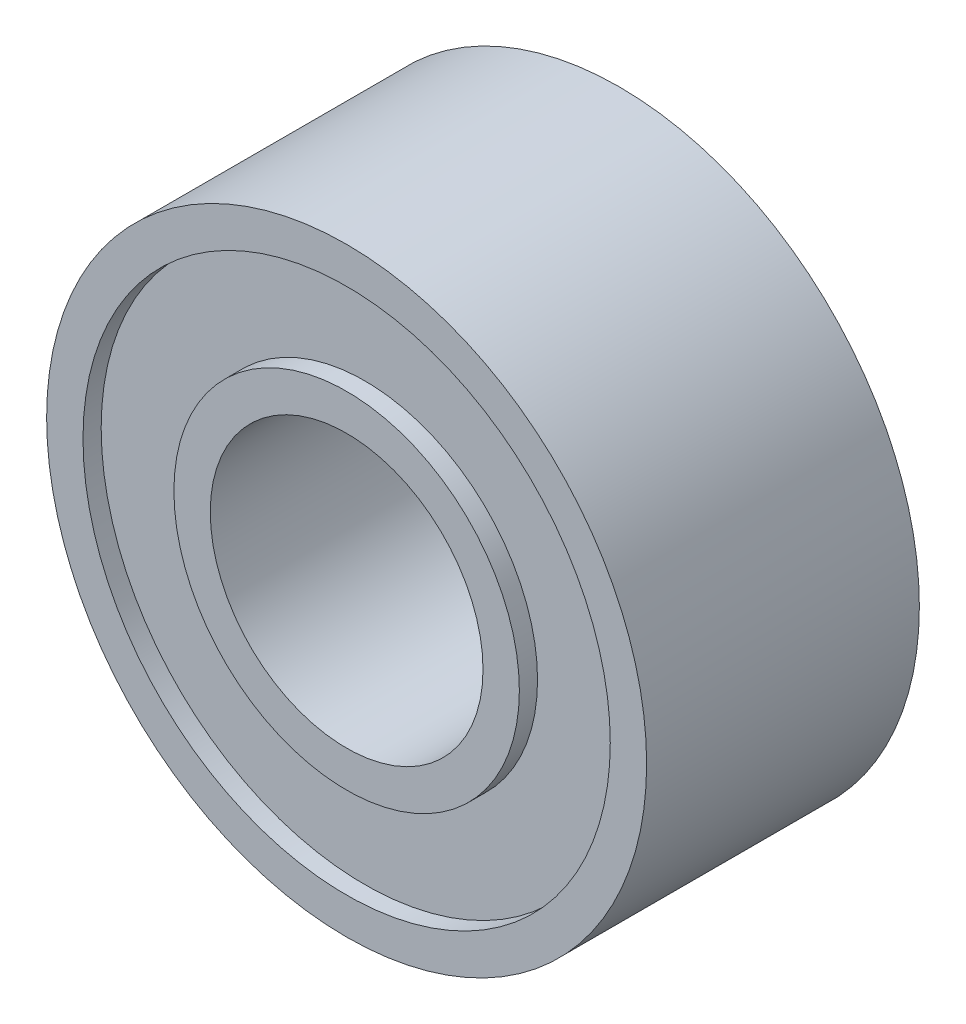
from build123d import *

# Parameters (mm, degrees)
SKETCH1_R           = 9.5
SKETCH1_R_2         = 7.5
BOSS_EXTRUDE1_DEPTH = 7.5
SKETCH4_R           = 14.5
SKETCH4_R_2         = 9.5
BOSS_EXTRUDE2_DEPTH = 6.5
SKETCH5_R           = 16.5
SKETCH5_R_2         = 14.5
BOSS_EXTRUDE3_DEPTH = 7.5


with BuildPart() as part:
    # Sketch1 → Boss-Extrude1 (new, symmetric)
    with BuildSketch(Plane.XY):
        Circle(SKETCH1_R)
        Circle(SKETCH1_R_2, mode=Mode.SUBTRACT)
    extrude(amount=BOSS_EXTRUDE1_DEPTH, both=True)

    # Sketch4 → Boss-Extrude2 (add, symmetric)
    with BuildSketch(Plane.XY):
        with Locations(Location((0, 0, 0), (0, 0, 180))):
            Circle(SKETCH4_R)
        Circle(SKETCH4_R_2, mode=Mode.SUBTRACT)
    extrude(amount=BOSS_EXTRUDE2_DEPTH, both=True)

    # Sketch5 → Boss-Extrude3 (add, symmetric)
    with BuildSketch(Plane.XY):
        Circle(SKETCH5_R)
        Circle(SKETCH5_R_2, mode=Mode.SUBTRACT)
    extrude(amount=BOSS_EXTRUDE3_DEPTH, both=True)


solid = part.part
